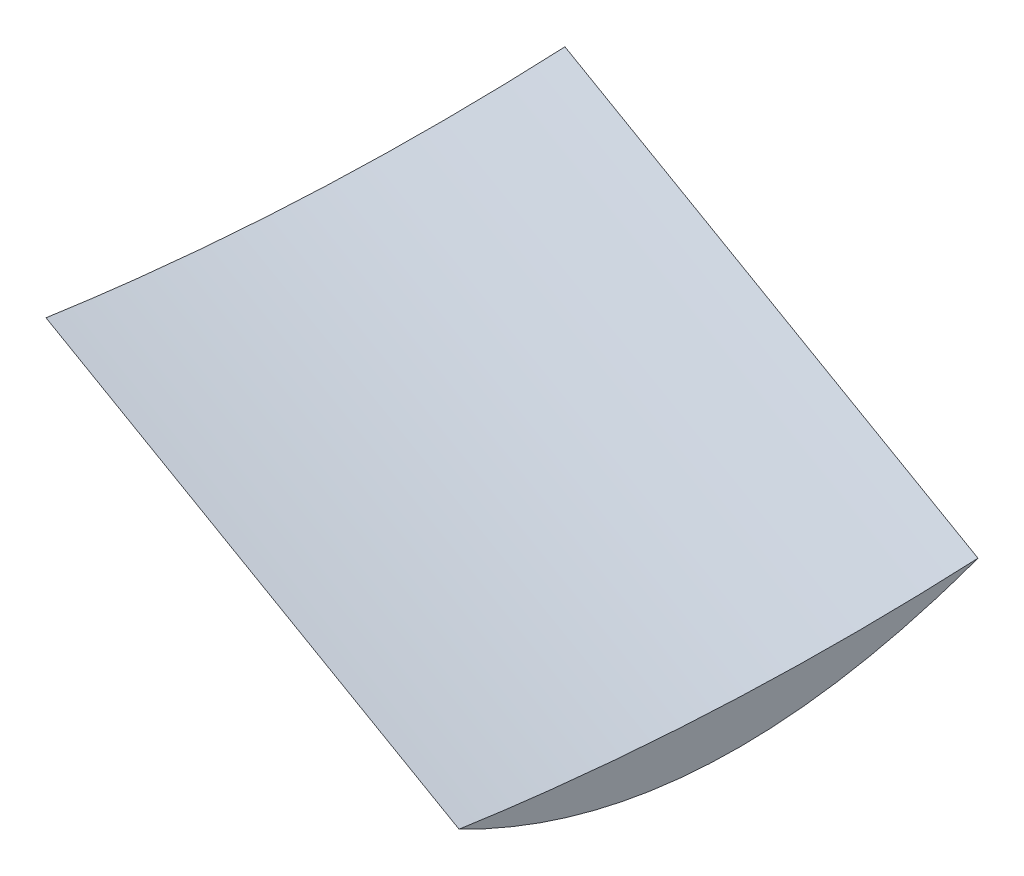
from build123d import *


with BuildPart() as part:
    # Sweep1: sweep along a path in Sketch2
    with BuildLine(Plane(origin=(0, 0, 0), x_dir=(1, 0, 0), z_dir=(0, 1, 0))) as sweep1_path:
        Line((0, -185.596834495), (-635, 45.524264264))
    # Sketch1 → Sweep1 (sweep)
    with BuildSketch(Plane(origin=(0, 0, 0), x_dir=(0, 0, -1), z_dir=(1, 0, 0))):
        with BuildLine():
            add(Edge.make_bspline(
                [(-44.991742267, 21.724903544), (207.265844034, -14.748396326), (462.429907732, -2.508732425)],
                knots=[0, 0, 0, 1, 1, 1], degree=2))
            add(Edge.make_bspline(
                [(-44.991742267, 21.724903544), (192.732864504, -100.101611134), (462.429907732, -2.508732425)],
                knots=[0, 0, 0, 1, 1, 1], degree=2))
        make_face()
    sweep(path=sweep1_path.line)


solid = part.part
